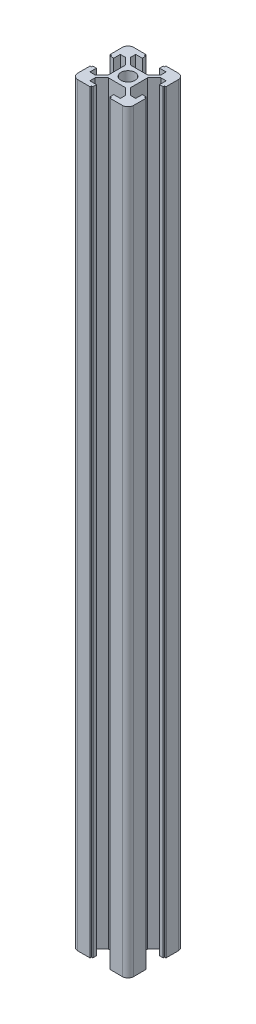
from build123d import *

# Parameters (mm, degrees)
SKETCH_1_R      = 2.5
EXTRUDE_1_DEPTH = 270


with BuildPart() as part:
    # 草图1 → 凸台-拉伸1 (new body)
    with BuildSketch(Plane(origin=(0, 0, 0), x_dir=(1, 0, 0), z_dir=(0, 1, 0))):
        with BuildLine():
            Line((-3.948528137, -3.1), (-6.298528137, -5.45))
            Line((-6.298528137, -5.45), (-8.2, -5.45))
            Line((-8.2, -5.45), (-8.2, -3.1))
            Line((-8.2, -3.1), (-9.5, -3.1))
            Line((-9.5, -3.1), (-9.5, -3.6))
            Line((-9.5, -3.6), (-10, -3.6))
            Line((-10, -3.6), (-10, -8))
            ThreePointArc((-10, -8), (-9.414213562, -9.414213562), (-8, -10))
            Line((-8, -10), (-3.6, -10))
            Line((-3.6, -10), (-3.6, -9.5))
            Line((-3.6, -9.5), (-3.1, -9.5))
            Line((-3.1, -9.5), (-3.1, -8.2))
            Line((-3.1, -8.2), (-5.45, -8.2))
            Line((-5.45, -8.2), (-5.45, -6.298528137))
            Line((-5.45, -6.298528137), (-3.1, -3.948528137))
            Line((-3.1, -3.948528137), (0, -3.948528137))
            Line((0, -3.948528137), (3.1, -3.948528137))
            Line((3.1, -3.948528137), (5.45, -6.298528137))
            Line((5.45, -6.298528137), (5.45, -8.2))
            Line((5.45, -8.2), (3.1, -8.2))
            Line((3.1, -8.2), (3.1, -9.5))
            Line((3.1, -9.5), (3.6, -9.5))
            Line((3.6, -9.5), (3.6, -10))
            Line((3.6, -10), (8, -10))
            ThreePointArc((8, -10), (9.414213562, -9.414213562), (10, -8))
            Line((10, -8), (10, -3.6))
            Line((10, -3.6), (9.5, -3.6))
            Line((9.5, -3.6), (9.5, -3.1))
            Line((9.5, -3.1), (8.2, -3.1))
            Line((8.2, -3.1), (8.2, -5.45))
            Line((8.2, -5.45), (6.298528137, -5.45))
            Line((6.298528137, -5.45), (3.948528137, -3.1))
            Line((3.948528137, -3.1), (3.948528137, 0))
            Line((3.948528137, 0), (3.948528137, 3.1))
            Line((3.948528137, 3.1), (6.298528137, 5.45))
            Line((6.298528137, 5.45), (8.2, 5.45))
            Line((8.2, 5.45), (8.2, 3.1))
            Line((8.2, 3.1), (9.5, 3.1))
            Line((9.5, 3.1), (9.5, 3.6))
            Line((9.5, 3.6), (10, 3.6))
            Line((10, 3.6), (10, 8))
            ThreePointArc((10, 8), (9.414213562, 9.414213562), (8, 10))
            Line((8, 10), (3.6, 10))
            Line((3.6, 10), (3.6, 9.5))
            Line((3.6, 9.5), (3.1, 9.5))
            Line((3.1, 9.5), (3.1, 8.2))
            Line((3.1, 8.2), (5.45, 8.2))
            Line((5.45, 8.2), (5.45, 6.298528137))
            Line((5.45, 6.298528137), (3.1, 3.948528137))
            Line((3.1, 3.948528137), (0, 3.948528137))
            Line((0, 3.948528137), (-3.1, 3.948528137))
            Line((-3.1, 3.948528137), (-5.45, 6.298528137))
            Line((-5.45, 6.298528137), (-5.45, 8.2))
            Line((-5.45, 8.2), (-3.1, 8.2))
            Line((-3.1, 8.2), (-3.1, 9.5))
            Line((-3.1, 9.5), (-3.6, 9.5))
            Line((-3.6, 9.5), (-3.6, 10))
            Line((-3.6, 10), (-8, 10))
            ThreePointArc((-8, 10), (-9.414213562, 9.414213562), (-10, 8))
            Line((-10, 8), (-10, 3.6))
            Line((-10, 3.6), (-9.5, 3.6))
            Line((-9.5, 3.6), (-9.5, 3.1))
            Line((-9.5, 3.1), (-8.2, 3.1))
            Line((-8.2, 3.1), (-8.2, 5.45))
            Line((-8.2, 5.45), (-6.298528137, 5.45))
            Line((-6.298528137, 5.45), (-3.948528137, 3.1))
            Line((-3.948528137, 3.1), (-3.948528137, 0))
            Line((-3.948528137, 0), (-3.948528137, -3.1))
        make_face()
        with Locations(Location((0, 0, 0), (0, 0, 270))):
            Circle(SKETCH_1_R, mode=Mode.SUBTRACT)
    extrude(amount=EXTRUDE_1_DEPTH)


solid = part.part
